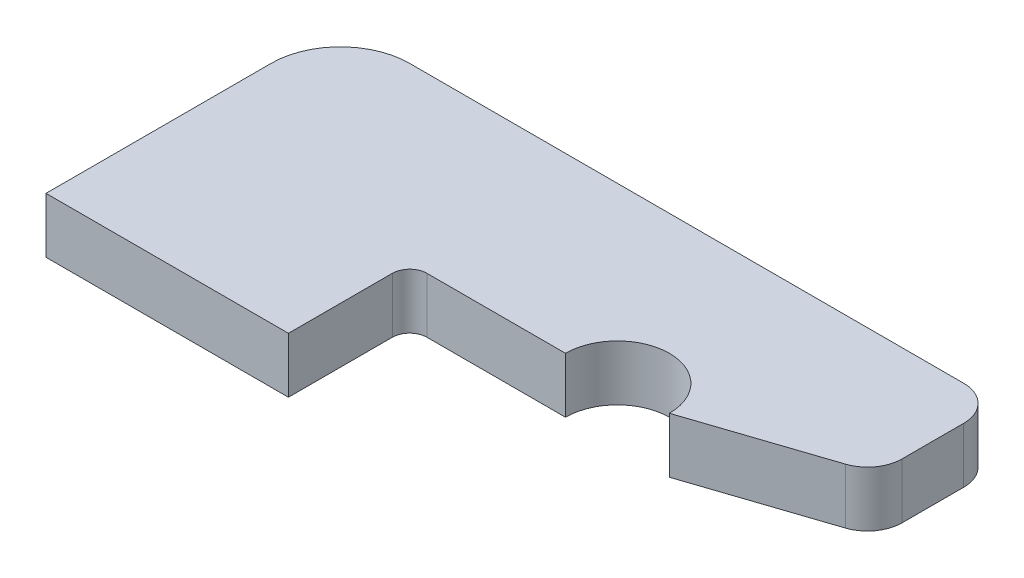
from build123d import *

# Parameters (mm, degrees)
ESBO_O2_W                = 12
ESBO_O2_H                = 5
RESSALTO_EXTRUS_O1_DEPTH = 1.6
ESBO_O3_R                = 1.5
CORTE_EXTRUS_O1_DEPTH    = 1.6
CORTE_EXTRUS_O2_DEPTH    = 1.6
FILETE1_R                = 1
FILETE2_R                = 1
FILETE6_R                = 0.5


with BuildPart() as part:
    # Esboço2 → Ressalto-extrusão1 (new body)
    with BuildSketch(Plane(origin=(0, 0, 0), x_dir=(1, 0, 0), z_dir=(0, 1, 0))):
        with BuildLine():
            Line((-3.5, 2.25), (-3.5, -4.25))
            Line((-3.5, -4.25), (3.5, -4.25))
            Line((3.5, -4.25), (3.5, -0.75))
            Line((3.5, -0.75), (3.5, 4.25))
            Line((3.5, 4.25), (-1.5, 4.25))
            ThreePointArc((-1.5, 4.25), (-2.914213562, 3.664213562), (-3.5, 2.25))
        make_face()
        with Locations((9.5, 1.75)):
            Rectangle(ESBO_O2_W, ESBO_O2_H)
    extrude(amount=RESSALTO_EXTRUS_O1_DEPTH)

    # Esboço3 → Corte-extrusão1 (cut)
    with BuildSketch(Plane(origin=(0, 1.6, 0), x_dir=(1, 0, 0), z_dir=(0, 1, 0))):
        with Locations((9.5, -0.75)):
            Circle(ESBO_O3_R)
    extrude(amount=-CORTE_EXTRUS_O1_DEPTH, mode=Mode.SUBTRACT)

    # Esboço4 → Corte-extrusão2 (cut)
    with BuildSketch(Plane(origin=(0, 1.6, 0), x_dir=(1, 0, 0), z_dir=(0, 1, 0))):
        Polygon((11, -0.75), (15.5, 0.75), (15.5, -0.75), align=None)
    extrude(amount=-CORTE_EXTRUS_O2_DEPTH, mode=Mode.SUBTRACT)

    # Filete1
    filete1_edges = [part.edges().sort_by_distance(p)[0] for p in [
        (15.5, 0.8, -0.75),
    ]]
    fillet(filete1_edges, radius=FILETE1_R)

    # Filete2
    filete2_edges = [part.edges().sort_by_distance(p)[0] for p in [
        (15.5, 0.8, -4.25),
    ]]
    fillet(filete2_edges, radius=FILETE2_R)

    # Filete6
    filete6_edges = [part.edges().sort_by_distance(p)[0] for p in [
        (3.5, 0.8, 0.75),
    ]]
    fillet(filete6_edges, radius=FILETE6_R)


solid = part.part
